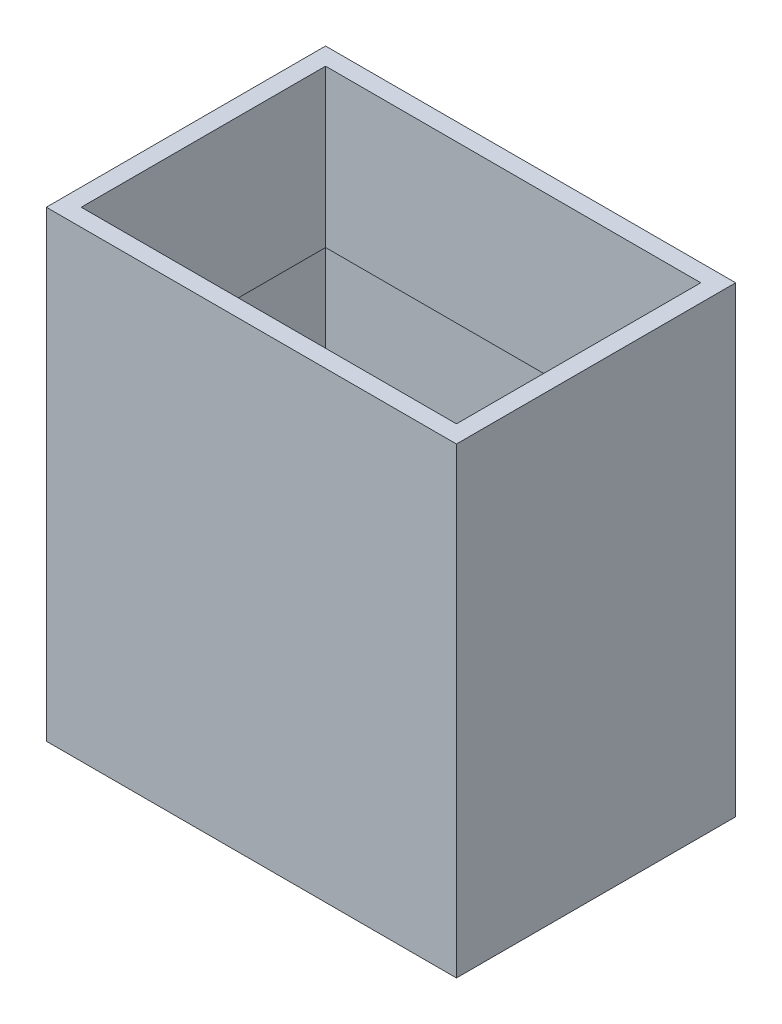
from build123d import *

# Parameters (mm, degrees)
SKETCH1_W           = 47
SKETCH1_H           = 32
SKETCH1_W_2         = 43
SKETCH1_H_2         = 28
BOSS_EXTRUDE1_DEPTH = 28
SKETCH2_W           = 44
SKETCH2_H           = 29
CUT_EXTRUDE1_DEPTH  = 10
SKETCH3_W           = 47
SKETCH3_H           = 32
SKETCH3_W_2         = 44
SKETCH3_H_2         = 29
BOSS_EXTRUDE2_DEPTH = 25
SKETCH4_W           = 47
SKETCH4_H           = 32
SKETCH4_R           = 6.5
BOSS_EXTRUDE3_DEPTH = 3
SKETCH5_R           = 5
SKETCH5_R_2         = 4
BOSS_EXTRUDE4_DEPTH = 5
SKETCH6_R           = 2.65
BOSS_EXTRUDE5_DEPTH = 5


with BuildPart() as part:
    # Sketch1 → Boss-Extrude1 (new body)
    with BuildSketch(Plane(origin=(0, 0, 0), x_dir=(1, 0, 0), z_dir=(0, 1, 0))):
        with Locations((23.5, 16)):
            Rectangle(SKETCH1_W, SKETCH1_H)
        with Locations((23.5, 16)):
            Rectangle(SKETCH1_W_2, SKETCH1_H_2, mode=Mode.SUBTRACT)
    extrude(amount=BOSS_EXTRUDE1_DEPTH)

    # Sketch2 → Cut-Extrude1 (cut)
    with BuildSketch(Plane.XZ):
        with Locations((23.5, -16)):
            Rectangle(SKETCH2_W, SKETCH2_H)
    extrude(amount=-CUT_EXTRUDE1_DEPTH, mode=Mode.SUBTRACT)

    # Sketch3 → Boss-Extrude2 (add)
    with BuildSketch(Plane.XZ):
        with Locations((23.5, -16)):
            Rectangle(SKETCH3_W, SKETCH3_H)
        with Locations((23.5, -16)):
            Rectangle(SKETCH3_W_2, SKETCH3_H_2, mode=Mode.SUBTRACT)
    extrude(amount=BOSS_EXTRUDE2_DEPTH)

    # Sketch4 → Boss-Extrude3 (add)
    with BuildSketch(Plane.XZ.offset(25)):
        with Locations((23.5, -16)):
            Rectangle(SKETCH4_W, SKETCH4_H)
        with Locations(Location((23.5, -16, 0), (0, 0, 270))):
            Circle(SKETCH4_R, mode=Mode.SUBTRACT)
    extrude(amount=-BOSS_EXTRUDE3_DEPTH)

    # Sketch5 → Boss-Extrude4 (add)
    # profile 1 of 2: a face of its own
    with BuildSketch(Plane.XZ.offset(25)):
        with Locations(Location((10, -16, 0), (0, 0, 270))):
            Circle(SKETCH5_R)
        with Locations(Location((10, -16, 0), (0, 0, 270))):
            Circle(SKETCH5_R_2, mode=Mode.SUBTRACT)
    # profile 2 of 2: a face of its own
    with BuildSketch(Plane.XZ.offset(25)):
        with Locations(Location((37, -16, 0), (0, 0, 270))):
            Circle(SKETCH5_R)
        with Locations(Location((37, -16, 0), (0, 0, 270))):
            Circle(SKETCH5_R_2, mode=Mode.SUBTRACT)
    extrude(amount=-BOSS_EXTRUDE4_DEPTH)

    # Sketch6 → Boss-Extrude5 (add)
    with BuildSketch(Plane.XZ.offset(25)):
        with Locations(Location((10, -16, 0), (0, 0, 270))):
            Circle(SKETCH6_R)
        with Locations(Location((37, -16, 0), (0, 0, 270))):
            Circle(SKETCH6_R)
    extrude(amount=-BOSS_EXTRUDE5_DEPTH)


solid = part.part
